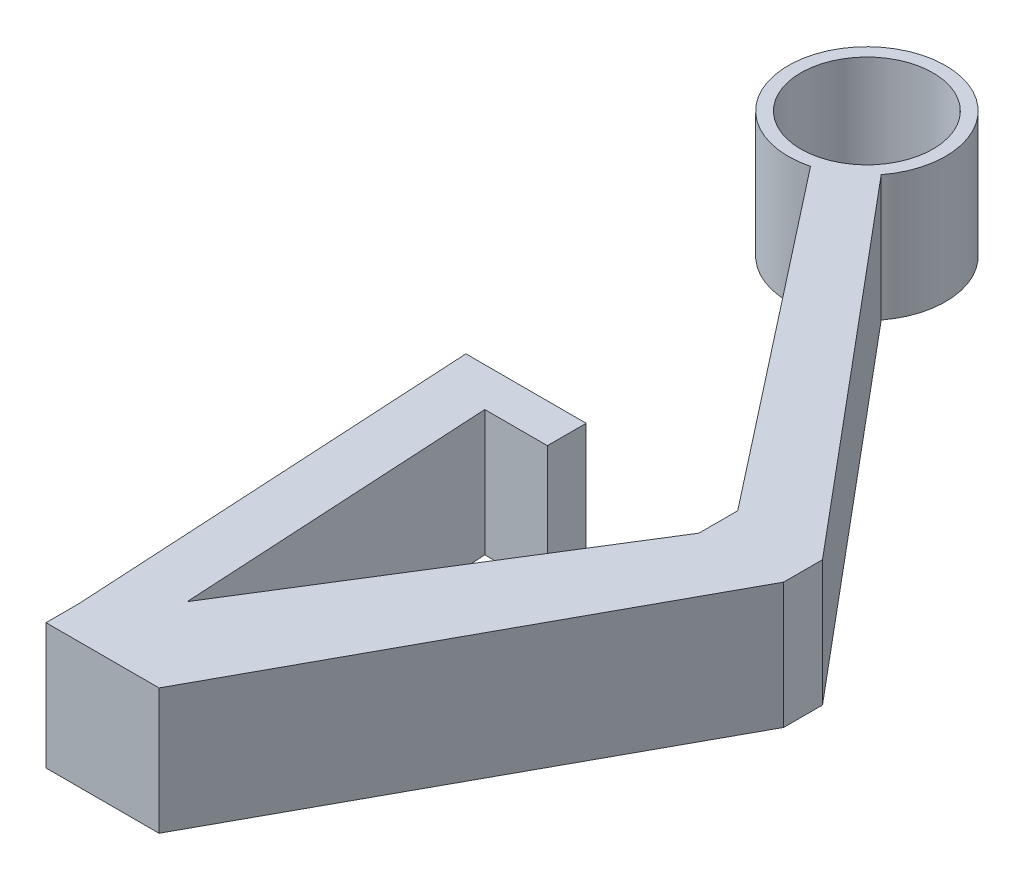
from build123d import *

# Parameters (mm, degrees)
SKETCH1_R           = 0.5
SKETCH1_R_2         = 0.42
BOSS_EXTRUDE1_DEPTH = 0.8
BOSS_EXTRUDE2_DEPTH = 0.8


with BuildPart() as part:
    # Sketch1 → Boss-Extrude1 (new body)
    with BuildSketch(Plane(origin=(0, 0, 0), x_dir=(1, 0, 0), z_dir=(0, 1, 0))):
        with Locations(Location((0, 0, 0), (0, 0, 270))):
            Circle(SKETCH1_R)
        with Locations(Location((0, 0, 0), (0, 0, 270))):
            Circle(SKETCH1_R_2, mode=Mode.SUBTRACT)
    extrude(amount=BOSS_EXTRUDE1_DEPTH)

    # Sketch2 → Boss-Extrude2 (add)
    with BuildSketch(Plane(origin=(0, 0, 0), x_dir=(1, 0, 0), z_dir=(0, 1, 0))):
        Polygon((0.108286112, -0.461724255), (1.789664547, -2.610569743), (1.789664547, -2.857049284), (0.540630382, -4.860515333), (0.428982179, -2.857049284), (0.826811996, -2.857049284), (0.826811996, -2.610569743), (0.062491975, -2.610569743), (0.207810173, -5.218225459), (0.207810173, -5.424104553), (0.926078261, -5.424104553), (2.328298725, -2.857049284), (2.328298725, -2.610569743), (0.39605028, -0.305195308), align=None)
    extrude(amount=BOSS_EXTRUDE2_DEPTH)


solid = part.part
